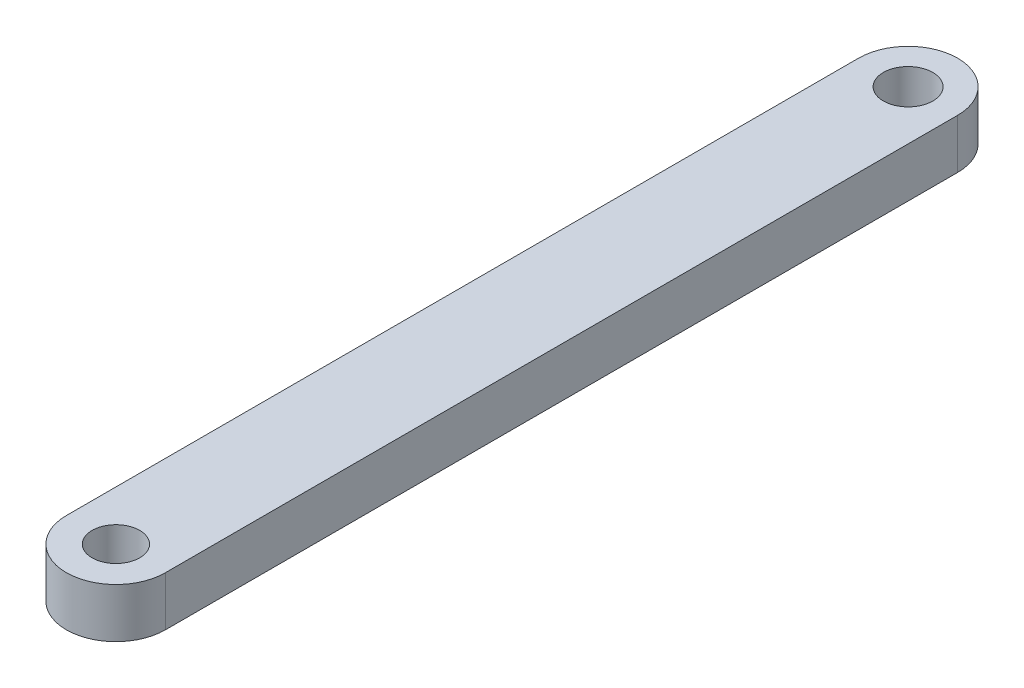
from build123d import *

# Parameters (mm, degrees)
SKETCH1_R           = 2.404574114
SKETCH1_R_2         = 2.5
BOSS_EXTRUDE3_DEPTH = 5


with BuildPart() as part:
    # Sketch1 → Boss-Extrude3 (new body)
    with BuildSketch(Plane(origin=(0, 0, 0), x_dir=(1, 0, 0), z_dir=(0, 1, 0))):
        with BuildLine():
            ThreePointArc((-5, 0), (0, -5), (5, 0))
            Line((5, 0), (5, 80))
            ThreePointArc((5, 80), (0, 85), (-5, 80))
            Line((-5, 80), (-5, 0))
        make_face()
        Circle(SKETCH1_R, mode=Mode.SUBTRACT)
        with Locations((0, 80)):
            Circle(SKETCH1_R_2, mode=Mode.SUBTRACT)
    extrude(amount=BOSS_EXTRUDE3_DEPTH)


solid = part.part
